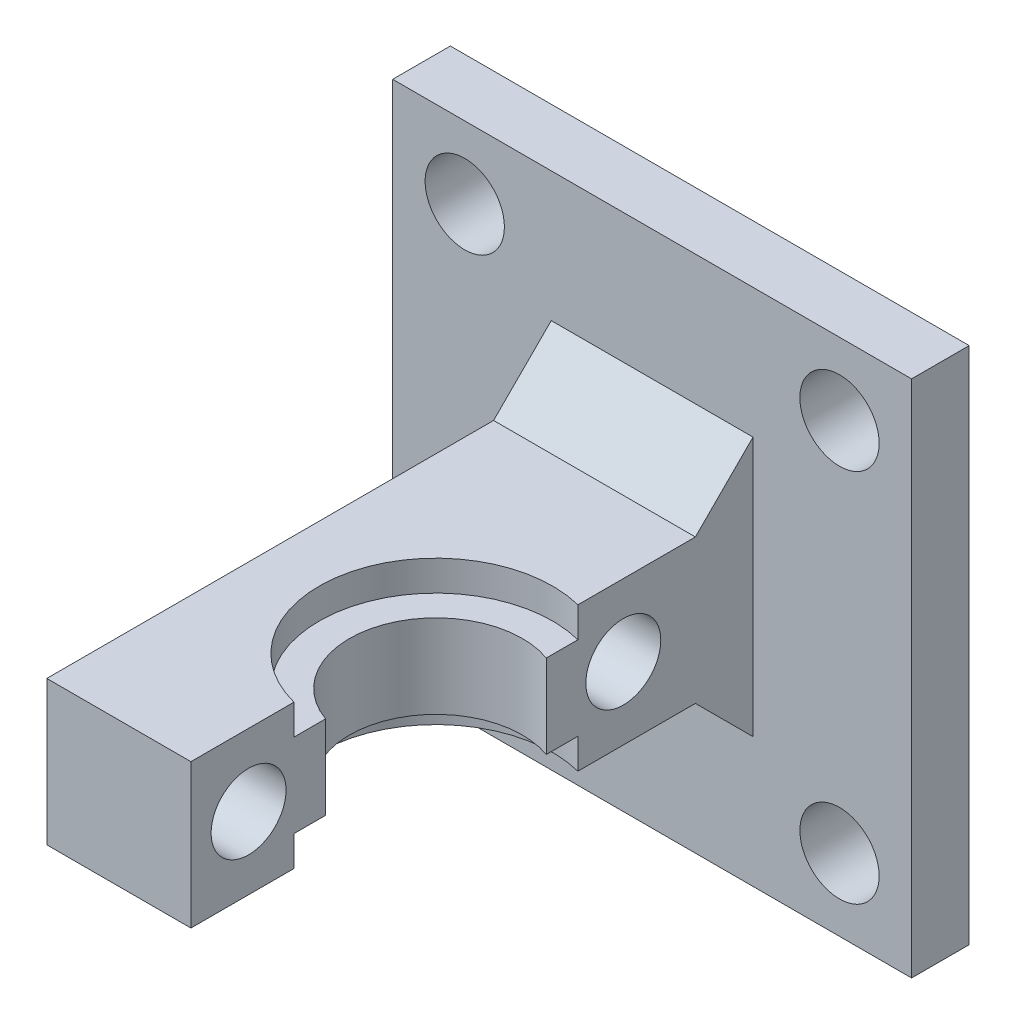
from build123d import *

# Parameters (mm, degrees)
SKETCH1_W           = 36
SKETCH1_H           = 36
BOSS_EXTRUDE1_DEPTH = 4
CUT_EXTRUDE1_REACH  = 27.768
SKETCH2_R           = 2.75
BOSS_EXTRUDE2_DEPTH = 5
CHAMFER1_SIZE       = 4
SKETCH4_R           = 2.6
CUT_EXTRUDE2_DEPTH  = 7
BOSS_EXTRUDE3_DEPTH = 2.9


with BuildPart() as part:
    # Sketch1 → Boss-Extrude1 (new body)
    with BuildSketch(Plane.XY):
        Rectangle(SKETCH1_W, SKETCH1_H)
    extrude(amount=BOSS_EXTRUDE1_DEPTH)

    # Sketch2 → Cut-Extrude1 (cut, up to next)
    with BuildSketch(Plane.XY, mode=Mode.PRIVATE) as cut_extrude1_sk1:
        with Locations((-13, 13)):
            Circle(SKETCH2_R)
    cut_extrude1_tool1 = extrude(cut_extrude1_sk1.sketch, amount=CUT_EXTRUDE1_REACH, mode=Mode.PRIVATE) & part.part
    # Sketch2 → Cut-Extrude1 (cut, up to next)
    with BuildSketch(Plane.XY, mode=Mode.PRIVATE) as cut_extrude1_sk2:
        with Locations(Location((13, 13, 0), (0, 0, 180))):
            Circle(SKETCH2_R)
    cut_extrude1_tool2 = extrude(cut_extrude1_sk2.sketch, amount=CUT_EXTRUDE1_REACH, mode=Mode.PRIVATE) & part.part
    # Sketch2 → Cut-Extrude1 (cut, up to next)
    with BuildSketch(Plane.XY, mode=Mode.PRIVATE) as cut_extrude1_sk3:
        with Locations((13, -13)):
            Circle(SKETCH2_R)
    cut_extrude1_tool3 = extrude(cut_extrude1_sk3.sketch, amount=CUT_EXTRUDE1_REACH, mode=Mode.PRIVATE) & part.part
    # Sketch2 → Cut-Extrude1 (cut, up to next)
    with BuildSketch(Plane.XY, mode=Mode.PRIVATE) as cut_extrude1_sk4:
        with Locations(Location((-13, -13, 0), (0, 0, 180))):
            Circle(SKETCH2_R)
    cut_extrude1_tool4 = extrude(cut_extrude1_sk4.sketch, amount=CUT_EXTRUDE1_REACH, mode=Mode.PRIVATE) & part.part
    add(cut_extrude1_tool1.solids().sort_by_distance((-13, 13, 0))[0], mode=Mode.SUBTRACT)
    add(cut_extrude1_tool2.solids().sort_by_distance((13, 13, 0))[0], mode=Mode.SUBTRACT)
    add(cut_extrude1_tool3.solids().sort_by_distance((13, -13, 0))[0], mode=Mode.SUBTRACT)
    add(cut_extrude1_tool4.solids().sort_by_distance((-13, -13, 0))[0], mode=Mode.SUBTRACT)

    # Sketch3 → Boss-Extrude2 (add, symmetric)
    with BuildSketch(Plane(origin=(0, 0, 0), x_dir=(1, 0, 0), z_dir=(0, 1, 0))):
        with BuildLine():
            Line((-7, -4), (-7, -39))
            Line((-7, -39), (3, -39))
            Line((3, -39), (3, -31.849203781))
            ThreePointArc((3, -31.849203781), (-2.849203781, -22), (7, -16.150796219))
            Line((7, -16.150796219), (7, -4))
            Line((7, -4), (-7, -4))
        make_face()
    extrude(amount=BOSS_EXTRUDE2_DEPTH, both=True)

    # Chamfer1
    chamfer1_edges = [part.edges().sort_by_distance(p)[0] for p in [
        (0, -5, 4),
        (0, 5, 4),
    ]]
    chamfer(chamfer1_edges, length=CHAMFER1_SIZE)

    # Sketch4 → Cut-Extrude2 (cut, symmetric)
    with BuildSketch(Plane(origin=(0, 0, 0), x_dir=(0, 0, -1), z_dir=(1, 0, 0))):
        with Locations((-13, 0)):
            Circle(SKETCH4_R)
        with Locations((-35, 0)):
            Circle(SKETCH4_R)
    extrude(amount=CUT_EXTRUDE2_DEPTH, both=True, mode=Mode.SUBTRACT)

    # Sketch5 → Boss-Extrude3 (add, symmetric)
    with BuildSketch(Plane(origin=(0, 0, 0), x_dir=(1, 0, 0), z_dir=(0, 1, 0))):
        with BuildLine():
            Line((7, -15.738644179), (7, -18.343145751))
            ThreePointArc((7, -18.343145751), (-0.656854249, -22), (3, -29.656854249))
            Line((3, -29.656854249), (3, -32.261355821))
            ThreePointArc((3, -32.261355821), (-3.261355821, -22), (7, -15.738644179))
        make_face()
    extrude(amount=BOSS_EXTRUDE3_DEPTH, both=True)


solid = part.part
